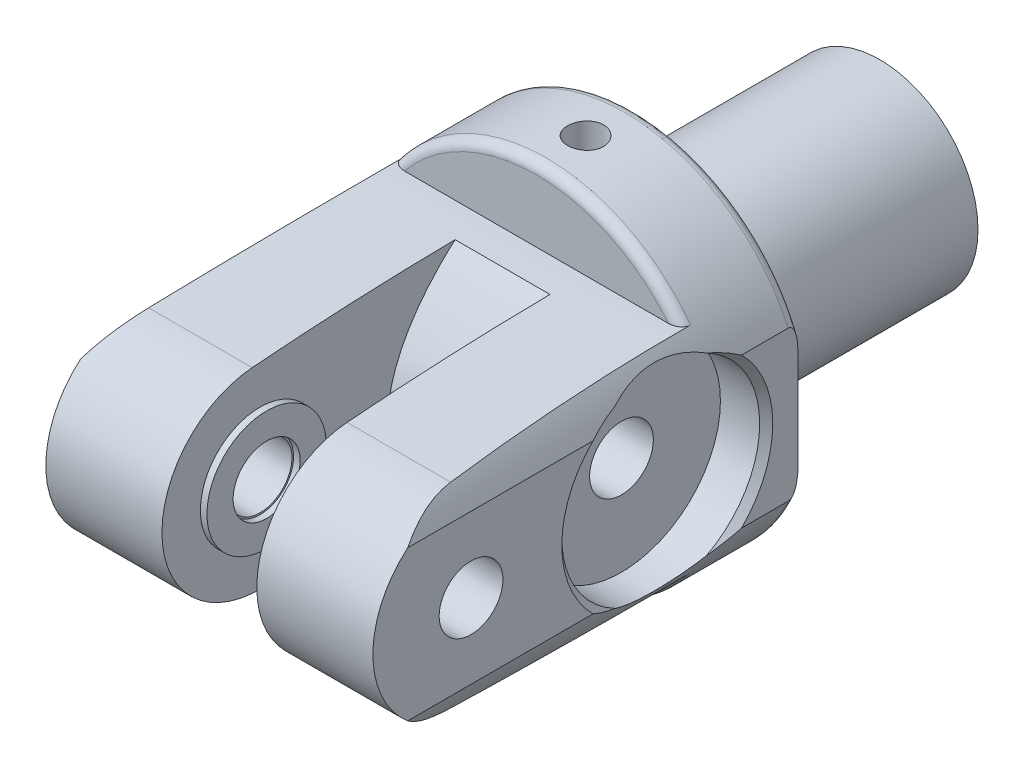
from build123d import *
from build123d.topology import SkipClean

# Parameters (mm, degrees)
EXTRUDE_1_DEPTH          = 3
EXTRUDE_3_DEPTH          = 5
EXTRUDE_3_DEPTH_BACK     = 5
SKETCH_5_R               = 6.36543
SKETCH_5_R_2             = 5.5
CUT_EXTRUDE_1_DEPTH      = 14
CUT_EXTRUDE_2_DEPTH      = 15.974979
CUT_EXTRUDE_2_DEPTH_BACK = 15.974979
SKETCH_6_R               = 0.975
SKETCH_7_R               = 3
SKETCH_7_R_2             = 0.9
EXTRUDE_4_DEPTH          = 7.5
CUT_EXTRUDE_3_DEPTH      = 1.45
CUT_EXTRUDE_3_DEPTH_BACK = 1.45
SKETCH_10_R              = 1.825
SKETCH_10_R_2            = 1.025
EXTRUDE_5_DEPTH          = 0.2
SKETCH_11_R              = 3.025
CUT_EXTRUDE_4_DEPTH      = 1.4
SKETCH_12_R              = 4.2
EXTRUDE_6_DEPTH          = 0.4
FILLET_3_R               = 0.3
CHAMFER_1_SIZE           = 0.2
SKETCH_14_R              = 1
CUT_EXTRUDE_5_DEPTH      = 5
SKETCH_15_R              = 0.55
CUT_EXTRUDE_6_DEPTH      = 7


with BuildPart() as part:
    # 草图1 → 凸台-拉伸1 (new body)
    with BuildSketch(Plane.XY):
        with BuildLine():
            Line((-5, 2.291288), (-5, -2.291288))
            ThreePointArc((-5, -2.291288), (0, -5.5), (5, -2.291288))
            Line((5, -2.291288), (5, 2.291288))
            ThreePointArc((5, 2.291288), (0, 5.5), (-5, 2.291288))
        make_face()
    extrude(amount=EXTRUDE_1_DEPTH)

    # 草图4 → 凸台-拉伸3 (add, two sides: drawn at the far end of the back side and taken through both)
    with BuildSketch(Plane(origin=(0, 0, 0), x_dir=(0, 0, -1), z_dir=(1, 0, 0)).offset(-EXTRUDE_3_DEPTH_BACK)):
        with BuildLine():
            Line((-3, 3.282066), (-3, -3.282066))
            ThreePointArc((-3, -3.282066), (-6.623628, -3.209089), (-10.241379, -2.990274))
            ThreePointArc((-10.241379, -2.990274), (-13, 0), (-10.241379, 2.990274))
            ThreePointArc((-10.241379, 2.990274), (-6.623628, 3.209089), (-3, 3.282066))
        make_face()
    extrude(amount=EXTRUDE_3_DEPTH + EXTRUDE_3_DEPTH_BACK)

    # 草图5 → 切除-拉伸1 (cut)
    with BuildSketch(Plane(origin=(0, 0, 0), x_dir=(-1, 0, 0), z_dir=(0, 0, -1))):
        Circle(SKETCH_5_R)
        Circle(SKETCH_5_R_2, mode=Mode.SUBTRACT)
    extrude(amount=-CUT_EXTRUDE_1_DEPTH, mode=Mode.SUBTRACT)

    # 草图6 → 切除-拉伸2 (cut, two sides: drawn at the far end of the back side and taken through both)
    with SkipClean():  # the faces are left unmerged after this step: merging them gives an invalid solid
        with BuildSketch(Plane(origin=(0, 0, 0), x_dir=(0, 0, -1), z_dir=(1, 0, 0)).offset(-CUT_EXTRUDE_2_DEPTH_BACK)):
            with Locations((-10, 0)):
                Circle(SKETCH_6_R)
            with Locations((-4, 0)):
                Circle(SKETCH_6_R)
        extrude(amount=CUT_EXTRUDE_2_DEPTH + CUT_EXTRUDE_2_DEPTH_BACK, mode=Mode.SUBTRACT)

    # 草图7 → 凸台-拉伸4 (add)
    with SkipClean():  # the faces are left unmerged after this step: merging them gives an invalid solid
        with BuildSketch(Plane(origin=(0, 0, 0), x_dir=(-1, 0, 0), z_dir=(0, 0, -1))):
            Circle(SKETCH_7_R)
            Circle(SKETCH_7_R_2, mode=Mode.SUBTRACT)
        extrude(amount=EXTRUDE_4_DEPTH)

    # 草图8 → 切除-拉伸3 (cut, two sides: drawn at the far end of the back side and taken through both)
    with SkipClean():  # the faces are left unmerged after this step: merging them gives an invalid solid
        with BuildSketch(Plane(origin=(0, 0, 0), x_dir=(0, 0, -1), z_dir=(1, 0, 0)).offset(-CUT_EXTRUDE_3_DEPTH_BACK)):
            with BuildLine():
                ThreePointArc((-4.037779, 3.276083), (-7.142045, 3.186702), (-10.241379, 2.990274))
                ThreePointArc((-10.241379, 2.990274), (-11.143646, 2.773459), (-11.936492, 2.291288))
                ThreePointArc((-11.936492, 2.291288), (-13, 0), (-11.936492, -2.291288))
                ThreePointArc((-11.936492, -2.291288), (-11.143646, -2.773459), (-10.241379, -2.990274))
                ThreePointArc((-10.241379, -2.990274), (-7.142045, -3.186702), (-4.037779, -3.276083))
                add(Edge.make_bspline(
                    [(-6.066615, 0), (-5.84656, -1.308935), (-5.00956, -2.417573), (-4.037779, -3.276083)],
                    knots=[0, 0, 0, 0, 1, 1, 1, 1], degree=3))
                add(Edge.make_bspline(
                    [(-6.066615, 0), (-5.84656, 1.308935), (-5.00956, 2.417573), (-4.037779, 3.276083)],
                    knots=[0, 0, 0, 0, 1, 1, 1, 1], degree=3))
            make_face()
        extrude(amount=CUT_EXTRUDE_3_DEPTH + CUT_EXTRUDE_3_DEPTH_BACK, mode=Mode.SUBTRACT)

    # 草图10 → 凸台-拉伸5 (add)
    with SkipClean():  # the faces are left unmerged after this step: merging them gives an invalid solid
        with BuildSketch(Plane.ZY.offset(-1.45)):
            with Locations((10, 0)):
                Circle(SKETCH_10_R)
            with Locations((10, 0)):
                Circle(SKETCH_10_R_2, mode=Mode.SUBTRACT)
        extrude_5 = extrude(amount=EXTRUDE_5_DEPTH)

    # 草图11 → 切除-拉伸4 (cut)
    with SkipClean():  # the faces are left unmerged after this step: merging them gives an invalid solid
        with BuildSketch(Plane(origin=(5, 0, 0), x_dir=(0, 0, -1), z_dir=(1, 0, 0))):
            with Locations((-4, 0)):
                Circle(SKETCH_11_R)
        cut_extrude_4 = extrude(amount=-CUT_EXTRUDE_4_DEPTH, mode=Mode.SUBTRACT)

    # 镜向1: 凸台-拉伸5, 切除-拉伸4 across plane
    with SkipClean():  # the faces are left unmerged after this step: merging them gives an invalid solid
        add(extrude_5.mirror(Plane(origin=(0, 0, 0), x_dir=(0, 0, 1), z_dir=(1, 0, 0))))
        add(cut_extrude_4.mirror(Plane(origin=(0, 0, 0), x_dir=(0, 0, 1), z_dir=(1, 0, 0))), mode=Mode.SUBTRACT)

    # 草图12 → 凸台-拉伸6 (add)
    with BuildSketch(Plane(origin=(0, 0, 0), x_dir=(-1, 0, 0), z_dir=(0, 0, -1))):
        Circle(SKETCH_12_R)
    extrude(amount=EXTRUDE_6_DEPTH)

    # 圆角3
    fillet_3_edges = [part.edges().sort_by_distance(p)[0] for p in [
        (0, -5.5, 3),
        (0, -5.5, 0),
        (0, 5.5, 3),
        (0, 5.5, 0),
    ]]
    fillet(fillet_3_edges, radius=FILLET_3_R)

    # 倒角1
    chamfer_1_edges = [part.edges().sort_by_distance(p)[0] for p in [
        (-5, 0, 7.025),
        (-5, 1.260208, 1.25),
        (5, -1.260208, 1.25),
        (5, 0, 7.025),
    ]]
    chamfer(chamfer_1_edges, length=CHAMFER_1_SIZE)

    # 草图14 → 切除-拉伸5 (cut)
    with SkipClean():  # the faces are left unmerged after this step: merging them gives an invalid solid
        with BuildSketch(Plane(origin=(0, -6, 0), x_dir=(1, 0, 0), z_dir=(0, 1, 0))):
            with Locations((0, -1.5)):
                Circle(SKETCH_14_R)
        extrude(amount=CUT_EXTRUDE_5_DEPTH, mode=Mode.SUBTRACT)

    # 草图15 → 切除-拉伸6 (cut)
    with SkipClean():  # the faces are left unmerged after this step: merging them gives an invalid solid
        with BuildSketch(Plane.XZ.offset(1)):
            with Locations((0, 1.5)):
                Circle(SKETCH_15_R)
        extrude(amount=-CUT_EXTRUDE_6_DEPTH, mode=Mode.SUBTRACT)


solid = part.part
